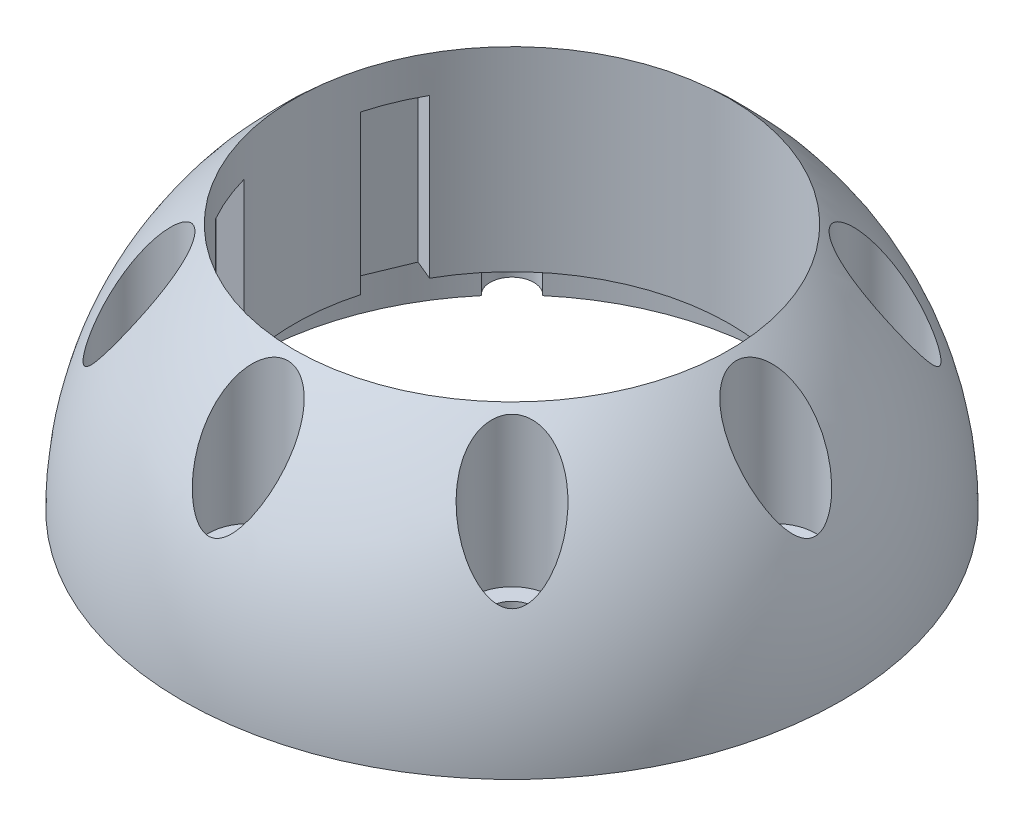
from build123d import *

# Parameters (mm, degrees)
REVOLVE1_ANGLE      = 180
SKETCH2_R           = 3
CUT_EXTRUDE2_DEPTH  = 27
SKETCH3_R           = 3
SKETCH3_R_2         = 1.5
BOSS_EXTRUDE1_DEPTH = 7
SKETCH4_R           = 20
CUT_EXTRUDE3_DEPTH  = 4
SKETCH5_R           = 16.5
CUT_EXTRUDE4_DEPTH  = 22
CUT_EXTRUDE5_DEPTH  = 12
SKETCH7_R           = 1.65
CUT_EXTRUDE6_DEPTH  = 10


with BuildPart() as part:
    # Sketch1 → Revolve1 (revolve)
    with BuildSketch(Plane(origin=(0, 0, 0), x_dir=(1, 0, 0), z_dir=(0, 1, 0))):
        with BuildLine():
            Line((-25, 0), (25, 0))
            ThreePointArc((25, 0), (0, 25), (-25, 0))
        make_face()
    revolve(axis=Axis((-25, 0, 0), (1, 0, 0)), revolution_arc=REVOLVE1_ANGLE)

    # Sketch2 → Cut-Extrude2 (cut)
    with BuildSketch(Plane.XZ):
        with Locations(Location((20, 0, 0), (0, 0, 270))):
            Circle(SKETCH2_R)
        with Locations(Location((14.142135624, -14.142135624, 0), (0, 0, 270))):
            Circle(SKETCH2_R)
        with Locations(Location((0, -20, 0), (0, 0, 270))):
            Circle(SKETCH2_R)
        with Locations(Location((-14.142135624, -14.142135624, 0), (0, 0, 270))):
            Circle(SKETCH2_R)
        with Locations(Location((-20, 0, 0), (0, 0, 270))):
            Circle(SKETCH2_R)
        with Locations(Location((-14.142135624, 14.142135624, 0), (0, 0, 270))):
            Circle(SKETCH2_R)
        with Locations(Location((0, 20, 0), (0, 0, 270))):
            Circle(SKETCH2_R)
        with Locations(Location((14.142135624, 14.142135624, 0), (0, 0, 270))):
            Circle(SKETCH2_R)
    extrude(amount=-CUT_EXTRUDE2_DEPTH, mode=Mode.SUBTRACT)

    # Sketch3 → Boss-Extrude1 (add)
    # profile 1 of 8: a face of its own
    with BuildSketch(Plane(origin=(0, 0, 0), x_dir=(-1, 0, 0), z_dir=(0, -1, 0))):
        with Locations(Location((-20, 0, 0), (0, 0, 90))):
            Circle(SKETCH3_R)
        with Locations(Location((-20, 0, 0), (0, 0, 90))):
            Circle(SKETCH3_R_2, mode=Mode.SUBTRACT)
    # profile 2 of 8: a face of its own
    with BuildSketch(Plane(origin=(0, 0, 0), x_dir=(-1, 0, 0), z_dir=(0, -1, 0))):
        with Locations(Location((-14.142135624, 14.142135624, 0), (0, 0, 90))):
            Circle(SKETCH3_R)
        with Locations(Location((-14.142135624, 14.142135624, 0), (0, 0, 90))):
            Circle(SKETCH3_R_2, mode=Mode.SUBTRACT)
    # profile 3 of 8: a face of its own
    with BuildSketch(Plane(origin=(0, 0, 0), x_dir=(-1, 0, 0), z_dir=(0, -1, 0))):
        with Locations(Location((0, 20, 0), (0, 0, 90))):
            Circle(SKETCH3_R)
        with Locations(Location((0, 20, 0), (0, 0, 90))):
            Circle(SKETCH3_R_2, mode=Mode.SUBTRACT)
    # profile 4 of 8: a face of its own
    with BuildSketch(Plane(origin=(0, 0, 0), x_dir=(-1, 0, 0), z_dir=(0, -1, 0))):
        with Locations(Location((14.142135624, 14.142135624, 0), (0, 0, 90))):
            Circle(SKETCH3_R)
        with Locations(Location((14.142135624, 14.142135624, 0), (0, 0, 90))):
            Circle(SKETCH3_R_2, mode=Mode.SUBTRACT)
    # profile 5 of 8: a face of its own
    with BuildSketch(Plane(origin=(0, 0, 0), x_dir=(-1, 0, 0), z_dir=(0, -1, 0))):
        with Locations(Location((20, 0, 0), (0, 0, 90))):
            Circle(SKETCH3_R)
        with Locations(Location((20, 0, 0), (0, 0, 90))):
            Circle(SKETCH3_R_2, mode=Mode.SUBTRACT)
    # profile 6 of 8: a face of its own
    with BuildSketch(Plane(origin=(0, 0, 0), x_dir=(-1, 0, 0), z_dir=(0, -1, 0))):
        with Locations(Location((14.142135624, -14.142135624, 0), (0, 0, 90))):
            Circle(SKETCH3_R)
        with Locations(Location((14.142135624, -14.142135624, 0), (0, 0, 90))):
            Circle(SKETCH3_R_2, mode=Mode.SUBTRACT)
    # profile 7 of 8: a face of its own
    with BuildSketch(Plane(origin=(0, 0, 0), x_dir=(-1, 0, 0), z_dir=(0, -1, 0))):
        with Locations(Location((0, -20, 0), (0, 0, 90))):
            Circle(SKETCH3_R)
        with Locations(Location((0, -20, 0), (0, 0, 90))):
            Circle(SKETCH3_R_2, mode=Mode.SUBTRACT)
    # profile 8 of 8: a face of its own
    with BuildSketch(Plane(origin=(0, 0, 0), x_dir=(-1, 0, 0), z_dir=(0, -1, 0))):
        with Locations(Location((-14.142135624, -14.142135624, 0), (0, 0, 90))):
            Circle(SKETCH3_R)
        with Locations(Location((-14.142135624, -14.142135624, 0), (0, 0, 90))):
            Circle(SKETCH3_R_2, mode=Mode.SUBTRACT)
    extrude(amount=-BOSS_EXTRUDE1_DEPTH)

    # Sketch4 → Cut-Extrude3 (cut)
    with BuildSketch(Plane.XZ):
        Circle(SKETCH4_R)
    extrude(amount=-CUT_EXTRUDE3_DEPTH, mode=Mode.SUBTRACT)

    # Sketch5 → Cut-Extrude4 (cut)
    with BuildSketch(Plane(origin=(0, 4, 0), x_dir=(-1, 0, 0), z_dir=(0, -1, 0))):
        with Locations(Location((0, 0, 0), (0, 0, 90))):
            Circle(SKETCH5_R)
    extrude(amount=-CUT_EXTRUDE4_DEPTH, mode=Mode.SUBTRACT)

    # Sketch6 → Cut-Extrude5 (cut)
    with BuildSketch(Plane.XZ.offset(-4)):
        Polygon((-17.39519845, -5.040542718), (-15.86446472, -8.736060848), (-12.387053793, -7.29567008), (-13.917787523, -3.60015195), align=None)
        Polygon((-17.39519845, 5.040542718), (-13.917787523, 3.60015195), (-12.387053793, 7.29567008), (-15.86446472, 8.736060848), align=None)
        Polygon((17.39519845, 5.040542718), (15.86446472, 8.736060848), (12.387053793, 7.29567008), (13.917787523, 3.60015195), align=None)
        Polygon((17.39519845, -5.040542718), (13.917787523, -3.60015195), (12.387053793, -7.29567008), (15.86446472, -8.736060848), align=None)
    extrude(amount=-CUT_EXTRUDE5_DEPTH, mode=Mode.SUBTRACT)

    # Sketch7 → Cut-Extrude6 (cut, symmetric)
    with BuildSketch(Plane.XZ.offset(-4)):
        with Locations(Location((14.142135624, 14.142135624, 0), (0, 0, 270))):
            Circle(SKETCH7_R)
        with Locations(Location((20, 0, 0), (0, 0, 270))):
            Circle(SKETCH7_R)
        with Locations(Location((14.142135624, -14.142135624, 0), (0, 0, 270))):
            Circle(SKETCH7_R)
        with Locations(Location((0, -20, 0), (0, 0, 270))):
            Circle(SKETCH7_R)
        with Locations(Location((-14.142135624, -14.142135624, 0), (0, 0, 270))):
            Circle(SKETCH7_R)
        with Locations(Location((-20, 0, 0), (0, 0, 270))):
            Circle(SKETCH7_R)
        with Locations(Location((-14.142135624, 14.142135624, 0), (0, 0, 270))):
            Circle(SKETCH7_R)
        with Locations(Location((0, 20, 0), (0, 0, 270))):
            Circle(SKETCH7_R)
    extrude(amount=CUT_EXTRUDE6_DEPTH, both=True, mode=Mode.SUBTRACT)


solid = part.part
